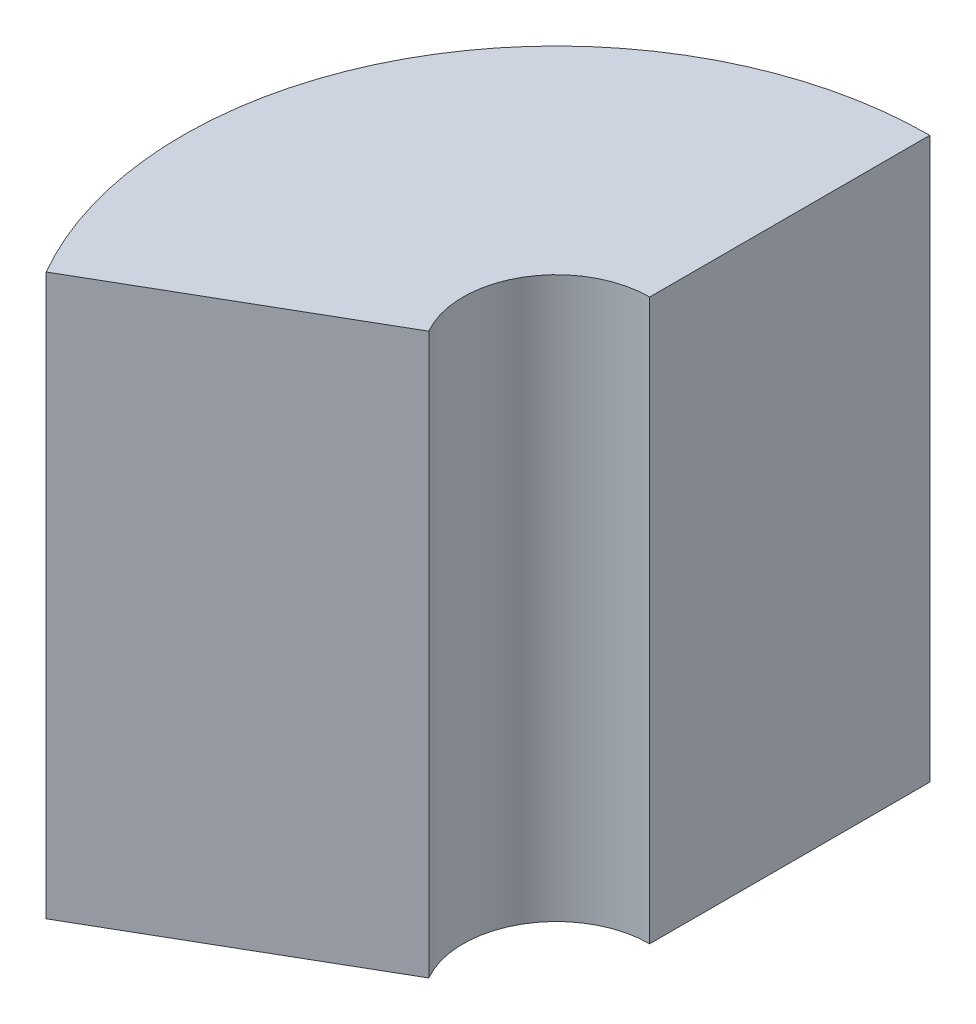
from build123d import *

# Parameters (mm, degrees)
SKETCH1_W      = 15
SKETCH1_H      = 30
REVOLVE1_ANGLE = 120


with BuildPart() as part:
    # Sketch1 → Revolve1 (revolve)
    with BuildSketch(Plane(origin=(0, 0, 0), x_dir=(0, 0, -1), z_dir=(1, 0, 0))):
        with Locations((12.5, 15)):
            Rectangle(SKETCH1_W, SKETCH1_H)
    revolve(axis=Axis((0, 0, 0), (0, 1, 0)), revolution_arc=REVOLVE1_ANGLE)


solid = part.part
